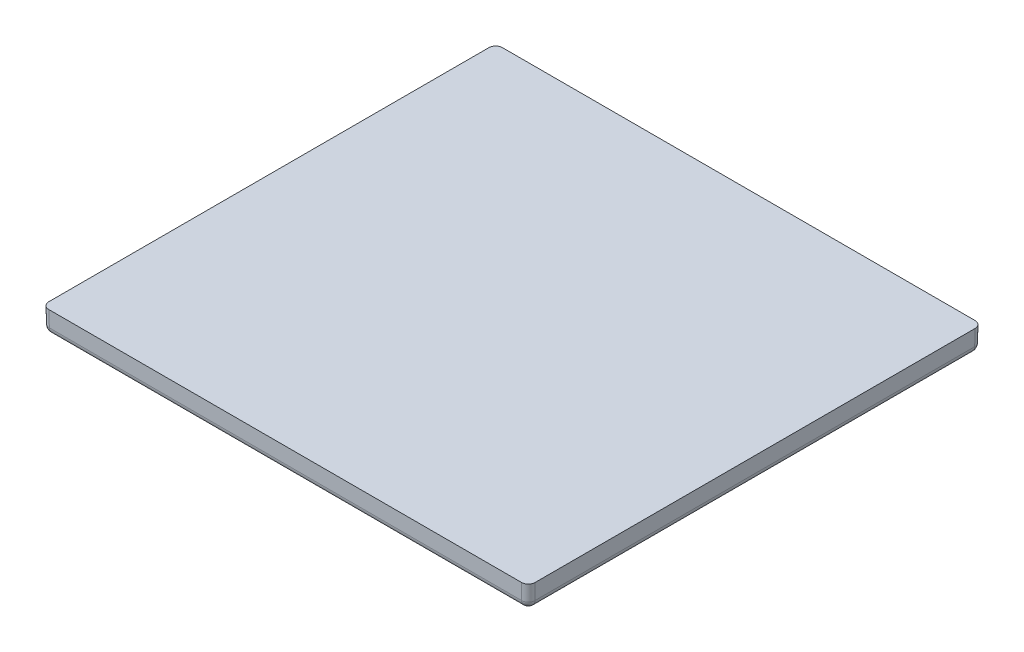
from build123d import *

# Parameters (mm, degrees)
SKETCH1_W           = 215.5
SKETCH1_H           = 201
BOSS_EXTRUDE1_DEPTH = 10
BOSS_EXTRUDE1_DRAFT = -1
FILLET1_R           = 3


with BuildPart() as part:
    # Sketch1 → Boss-Extrude1 (with draft: the straight prism first)
    with BuildSketch(Plane(origin=(0, 0, 0), x_dir=(1, 0, 0), z_dir=(0, 1, 0))):
        Rectangle(SKETCH1_W, SKETCH1_H)
    extrude(amount=BOSS_EXTRUDE1_DEPTH)
    # Boss-Extrude1: the draft: its side faces are tilted about the plane it starts from
    boss_extrude1_sides = [part.faces().sort_by_distance(p)[0] for p in [
        (0, 5, 100.5),
        (107.75, 5, 0),
        (0, 5, -100.5),
        (-107.75, 5, 0),
    ]]
    draft(boss_extrude1_sides, Plane(origin=(0, 0, 0), x_dir=(1, 0, 0), z_dir=(0, 1, 0)), BOSS_EXTRUDE1_DRAFT)

    # Fillet1
    fillet1_edges = [part.edges().sort_by_distance(p)[0] for p in [
        (0, 0, -100.5),
        (-107.837275325, 5, -100.587275325),
        (107.837275325, 5, -100.587275325),
        (107.75, 0, 0),
        (107.837275325, 5, 100.587275325),
        (-107.75, 0, 0),
        (0, 0, 100.5),
        (-107.837275325, 5, 100.587275325),
    ]]
    fillet(fillet1_edges, radius=FILLET1_R)


solid = part.part
